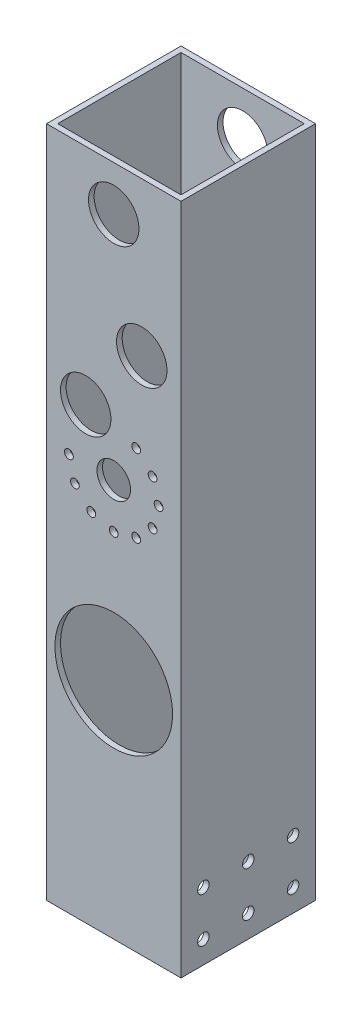
from build123d import *

# Parameters (mm, degrees)
SKETCH1_W           = 76.2
SKETCH1_H           = 76.2
SKETCH1_W_2         = 69.85
SKETCH1_H_2         = 69.85
BOSS_EXTRUDE1_DEPTH = 381
SKETCH2_R           = 14.2875
SKETCH2_R_2         = 9.525
SKETCH2_R_3         = 2.4892
CUT_EXTRUDE1_DEPTH  = 304.8
SKETCH3_R           = 33.3375
CUT_EXTRUDE2_DEPTH  = 47.625
SKETCH5_R           = 14.2875
SKETCH5_R_2         = 9.525
CUT_EXTRUDE3_DEPTH  = 83.185
SKETCH6_R           = 33.3375
CUT_EXTRUDE4_DEPTH  = 47.625
SKETCH7_R           = 2.4892
CUT_EXTRUDE5_DEPTH  = 47.625
SKETCH10_R          = 3.2639
CUT_EXTRUDE7_DEPTH  = 391.408824183


with BuildPart() as part:
    # Sketch1 → Boss-Extrude1 (new body)
    with BuildSketch(Plane(origin=(0, 0, 0), x_dir=(1, 0, 0), z_dir=(0, 1, 0))):
        Rectangle(SKETCH1_W, SKETCH1_H)
        Rectangle(SKETCH1_W_2, SKETCH1_H_2, mode=Mode.SUBTRACT)
    extrude(amount=BOSS_EXTRUDE1_DEPTH)

    # Sketch2 → Cut-Extrude1 (cut)
    with BuildSketch(Plane(origin=(0, 0, -38.1), x_dir=(-1, 0, 0), z_dir=(0, 0, -1))):
        with Locations((0, 355.6)):
            Circle(SKETCH2_R)
        with Locations((0, 127)):
            Circle(SKETCH2_R_2)
        with Locations((0, 152.4)):
            Circle(SKETCH2_R_3)
        with Locations((12.7, 148.997045256)):
            Circle(SKETCH2_R_3)
        with Locations((21.997045256, 139.7)):
            Circle(SKETCH2_R_3)
        with Locations((25.4, 127)):
            Circle(SKETCH2_R_3)
        with Locations((21.997045256, 114.3)):
            Circle(SKETCH2_R_3)
        with Locations((12.7, 105.002954744)):
            Circle(SKETCH2_R_3)
        with Locations((0, 101.6)):
            Circle(SKETCH2_R_3)
        with Locations((-12.7, 105.002954744)):
            Circle(SKETCH2_R_3)
        with Locations((-21.997045256, 114.3)):
            Circle(SKETCH2_R_3)
        with Locations((-25.4, 127)):
            Circle(SKETCH2_R_3)
        with Locations((-21.997045256, 139.7)):
            Circle(SKETCH2_R_3)
        with Locations((-12.7, 148.997045256)):
            Circle(SKETCH2_R_3)
    extrude(amount=-CUT_EXTRUDE1_DEPTH, mode=Mode.SUBTRACT)

    # Sketch3 → Cut-Extrude2 (cut)
    with BuildSketch(Plane.XY.offset(38.1)):
        with Locations((0, 127)):
            Circle(SKETCH3_R)
    extrude(amount=-CUT_EXTRUDE2_DEPTH, mode=Mode.SUBTRACT)

    # Sketch5 → Cut-Extrude3 (cut)
    with BuildSketch(Plane(origin=(0, 0, -38.1), x_dir=(-1, 0, 0), z_dir=(0, 0, -1))):
        with Locations((-15.875, 294.037693501)):
            Circle(SKETCH5_R)
        with Locations((15.875, 254.284388904)):
            Circle(SKETCH5_R)
        with Locations((0, 225.244023385)):
            Circle(SKETCH5_R_2)
    extrude(amount=-CUT_EXTRUDE3_DEPTH, mode=Mode.SUBTRACT)

    # Sketch6 → Cut-Extrude4 (cut)
    with BuildSketch(Plane(origin=(0, 0, -38.1), x_dir=(-1, 0, 0), z_dir=(0, 0, -1))):
        with Locations((0, 225.244023385)):
            Circle(SKETCH6_R)
    extrude(amount=-CUT_EXTRUDE4_DEPTH, mode=Mode.SUBTRACT)

    # Sketch7 → Cut-Extrude5 (cut)
    with BuildSketch(Plane.XY.offset(38.1)):
        with Locations((0, 199.844023385)):
            Circle(SKETCH7_R)
        with Locations((-12.7, 203.246978129)):
            Circle(SKETCH7_R)
        with Locations((-21.997045256, 212.544023385)):
            Circle(SKETCH7_R)
        with Locations((-25.4, 225.244023385)):
            Circle(SKETCH7_R)
        with Locations((12.7, 247.241068641)):
            Circle(SKETCH7_R)
        with Locations((21.997045256, 237.944023385)):
            Circle(SKETCH7_R)
        with Locations((25.4, 225.244023385)):
            Circle(SKETCH7_R)
        with Locations((21.997045256, 212.544023385)):
            Circle(SKETCH7_R)
        with Locations((12.7, 203.246978129)):
            Circle(SKETCH7_R)
    extrude(amount=-CUT_EXTRUDE5_DEPTH, mode=Mode.SUBTRACT)

    # Sketch10 → Cut-Extrude7 (cut, through all)
    with BuildSketch(Plane.ZY.offset(38.1)):
        with Locations((-25.4, 12.7)):
            Circle(SKETCH10_R)
        with Locations((0, 12.7)):
            Circle(SKETCH10_R)
        with Locations((25.4, 12.7)):
            Circle(SKETCH10_R)
        with Locations((0, 38.1)):
            Circle(SKETCH10_R)
        with Locations((25.4, 38.1)):
            Circle(SKETCH10_R)
        with Locations((-25.4, 38.1)):
            Circle(SKETCH10_R)
    extrude(amount=-CUT_EXTRUDE7_DEPTH, mode=Mode.SUBTRACT)


solid = part.part
